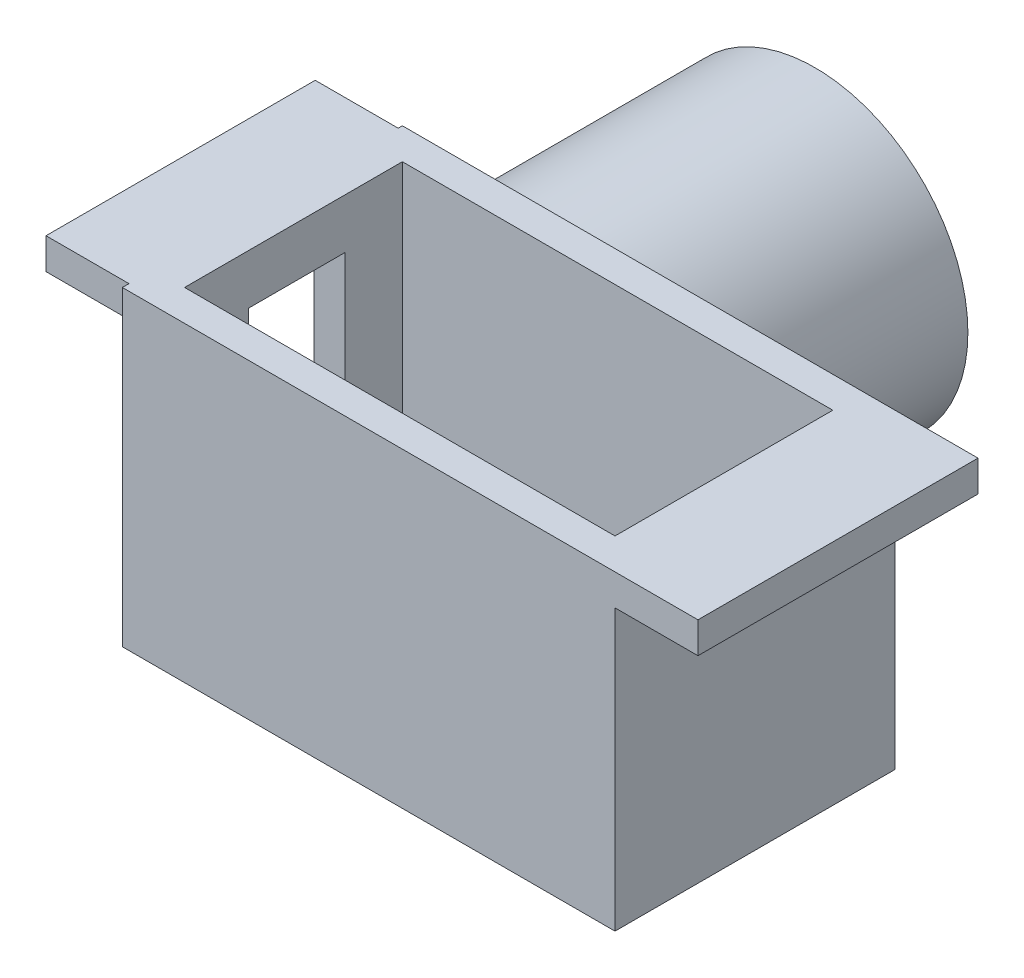
from build123d import *

# Parameters (mm, degrees)
SKETCH1_W           = 47.5
SKETCH1_H           = 27
SKETCH1_W_2         = 41.5
SKETCH1_H_2         = 21
BOSS_EXTRUDE2_DEPTH = 30
SKETCH2_W           = 9.308114218
SKETCH2_H           = 23.373709037
CUT_EXTRUDE1_DEPTH  = 30
SKETCH3_W           = 25.956751415
SKETCH3_H           = 3
BOSS_EXTRUDE3_DEPTH = 8
SKETCH4_W           = 27
SKETCH4_H           = 3
BOSS_EXTRUDE4_DEPTH = 8
SKETCH5_R           = 14.75
SKETCH5_R_2         = 12.75
BOSS_EXTRUDE5_DEPTH = 25


with BuildPart() as part:
    # Sketch1 → Boss-Extrude2 (new body)
    with BuildSketch(Plane(origin=(0, 0, 0), x_dir=(1, 0, 0), z_dir=(0, 1, 0))):
        with Locations((34.749341264, 5.949225985)):
            Rectangle(SKETCH1_W, SKETCH1_H)
        with Locations((34.749341264, 5.949225985)):
            Rectangle(SKETCH1_W_2, SKETCH1_H_2, mode=Mode.SUBTRACT)
    extrude(amount=-BOSS_EXTRUDE2_DEPTH)

    # Sketch2 → Cut-Extrude1 (cut)
    with BuildSketch(Plane.ZY.offset(-10.999341264)):
        with Locations((-6.259496459, -16.501916984)):
            Rectangle(SKETCH2_W, SKETCH2_H)
    extrude(amount=-CUT_EXTRUDE1_DEPTH, mode=Mode.SUBTRACT)

    # Sketch3 → Boss-Extrude3 (add)
    with BuildSketch(Plane.ZY.offset(-10.999341264)):
        with Locations((-6.067211219, -1.5)):
            Rectangle(SKETCH3_W, SKETCH3_H)
    extrude(amount=BOSS_EXTRUDE3_DEPTH)

    # Sketch4 → Boss-Extrude4 (add)
    with BuildSketch(Plane(origin=(58.499341264, 0, 0), x_dir=(0, 0, -1), z_dir=(1, 0, 0))):
        with Locations((5.949225985, -1.5)):
            Rectangle(SKETCH4_W, SKETCH4_H)
    extrude(amount=BOSS_EXTRUDE4_DEPTH)

    # Sketch5 → Boss-Extrude5 (add)
    with BuildSketch(Plane(origin=(0, 0, -19.449225985), x_dir=(-1, 0, 0), z_dir=(0, 0, -1))):
        with Locations(Location((-25.775893869, -15, 0), (0, 0, 180))):
            Circle(SKETCH5_R)
        with Locations((-25.775893869, -15)):
            Circle(SKETCH5_R_2, mode=Mode.SUBTRACT)
    extrude(amount=BOSS_EXTRUDE5_DEPTH)


solid = part.part
